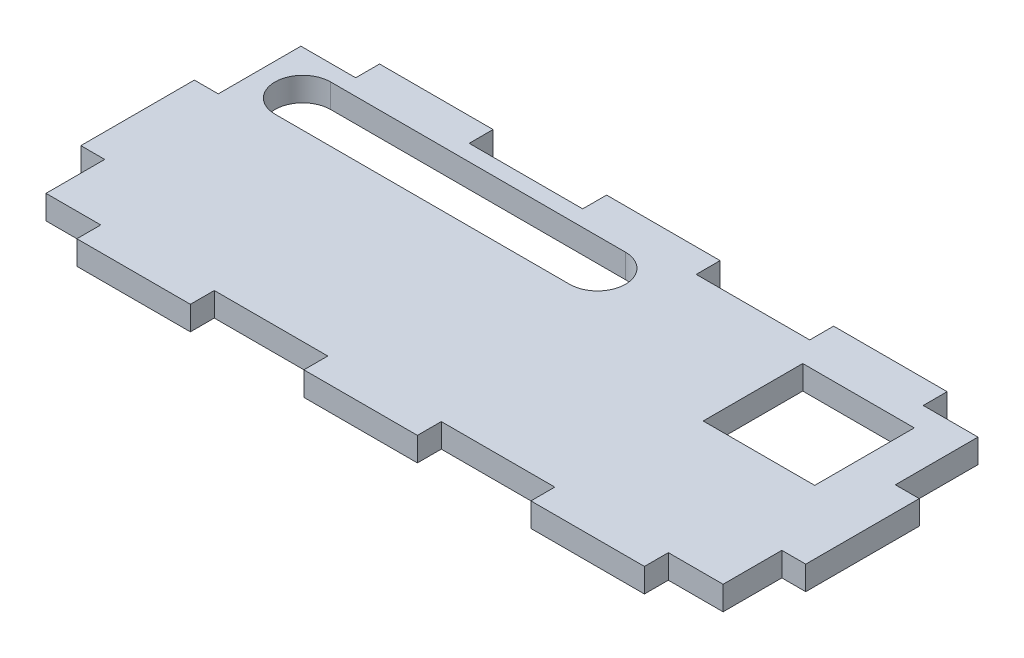
from build123d import *

# Parameters (mm, degrees)
BOSS_EXTRUDE1_DEPTH = 3
SKETCH2_W           = 14
SKETCH2_H           = 12.5
CUT_EXTRUDE1_DEPTH  = 10


with BuildPart() as part:
    # Sketch1 → Boss-Extrude1 (new body)
    with BuildSketch(Plane(origin=(0, 0, 0), x_dir=(1, 0, 0), z_dir=(0, 1, 0))):
        Polygon((-42.760092083, 15.020184167), (-42.760092083, 4.645184167), (-45.760092083, 4.645184167), (-45.760092083, -9.604815833), (-42.760092083, -9.604815833), (-42.760092083, -16.979815833), (-35.885092083, -16.979815833), (-35.885092083, -19.979815833), (-21.635092083, -19.979815833), (-21.635092083, -16.979815833), (-7.385092083, -16.979815833), (-7.385092083, -19.979815833), (6.864907917, -19.979815833), (6.864907917, -16.979815833), (21.114907917, -16.979815833), (21.114907917, -19.979815833), (35.364907917, -19.979815833), (35.364907917, -16.979815833), (42.239907917, -16.979815833), (42.239907917, -9.604815833), (45.239907917, -9.604815833), (45.239907917, 4.645184167), (42.239907917, 4.645184167), (42.239907917, 15.020184167), (35.364907917, 15.020184167), (35.364907917, 18.020184167), (21.114907917, 18.020184167), (21.114907917, 15.020184167), (6.864907917, 15.020184167), (6.864907917, 18.020184167), (-7.385092083, 18.020184167), (-7.385092083, 15.020184167), (-21.635092083, 15.020184167), (-21.635092083, 18.020184167), (-35.885092083, 18.020184167), (-35.885092083, 15.020184167), align=None)
    extrude(amount=BOSS_EXTRUDE1_DEPTH)

    # Sketch2 → Cut-Extrude1 (cut)
    with BuildSketch(Plane(origin=(0, 3, 0), x_dir=(1, 0, 0), z_dir=(0, 1, 0))):
        with Locations((30.239907917, 5.770184167)):
            Rectangle(SKETCH2_W, SKETCH2_H)
        with BuildLine():
            Line((-37, 12.998362663), (0, 12.998362663))
            ThreePointArc((0, 12.998362663), (3.5, 9.498362663), (0, 5.998362663))
            Line((0, 5.998362663), (-37, 5.998362663))
            ThreePointArc((-37, 5.998362663), (-40.5, 9.498362663), (-37, 12.998362663))
        make_face()
    extrude(amount=-CUT_EXTRUDE1_DEPTH, mode=Mode.SUBTRACT)


solid = part.part
